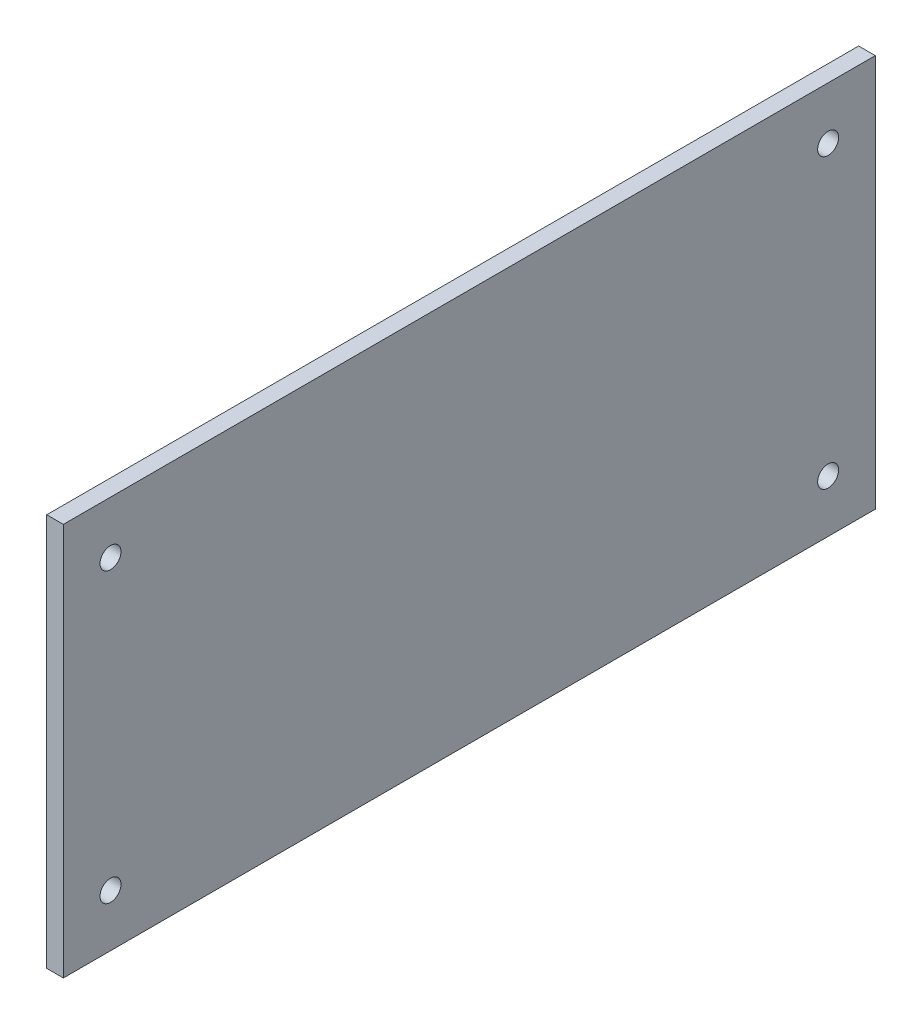
from build123d import *

# Parameters (mm, degrees)
SKETCH3_W           = 155
SKETCH3_H           = 75
SKETCH3_R           = 2
BOSS_EXTRUDE1_DEPTH = 3.175


with BuildPart() as part:
    # Sketch3 → Boss-Extrude1 (new body)
    with BuildSketch(Plane(origin=(0, 0, 0), x_dir=(0, 0, -1), z_dir=(1, 0, 0))):
        with Locations((77.5, 37.5)):
            Rectangle(SKETCH3_W, SKETCH3_H)
        with Locations((9, 10)):
            Circle(SKETCH3_R, mode=Mode.SUBTRACT)
        with Locations((146, 10)):
            Circle(SKETCH3_R, mode=Mode.SUBTRACT)
        with Locations((146, 65)):
            Circle(SKETCH3_R, mode=Mode.SUBTRACT)
        with Locations((9, 65)):
            Circle(SKETCH3_R, mode=Mode.SUBTRACT)
    extrude(amount=BOSS_EXTRUDE1_DEPTH)


solid = part.part
